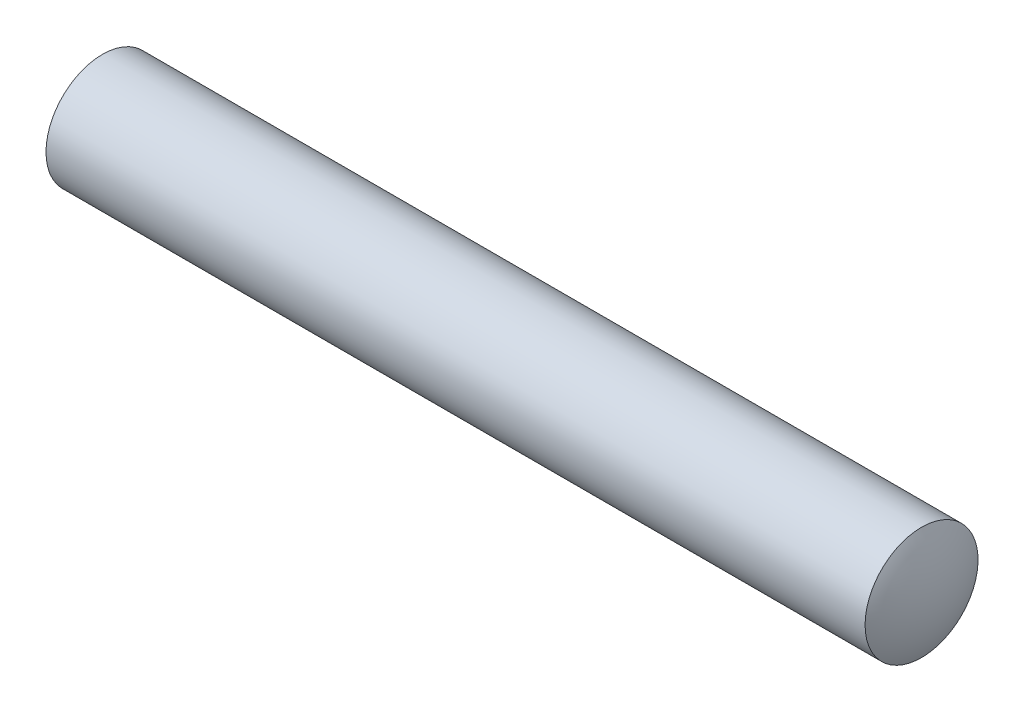
from build123d import *


with BuildPart() as part:
    # Эскиз1 → Повернуть1 (revolve)
    with BuildSketch(Plane.XY):
        with BuildLine():
            Line((-0.5, 2), (-29.5, 2))
            ThreePointArc((-29.5, 2), (-29.873105626, 1.030776406), (-30, 0))
            Line((-30, 0), (0, 0))
            ThreePointArc((0, 0), (-0.126894374, 1.030776406), (-0.5, 2))
        make_face()
    revolve(axis=Axis((-31.988120837, 0, 0), (1, 0, 0)))


solid = part.part
